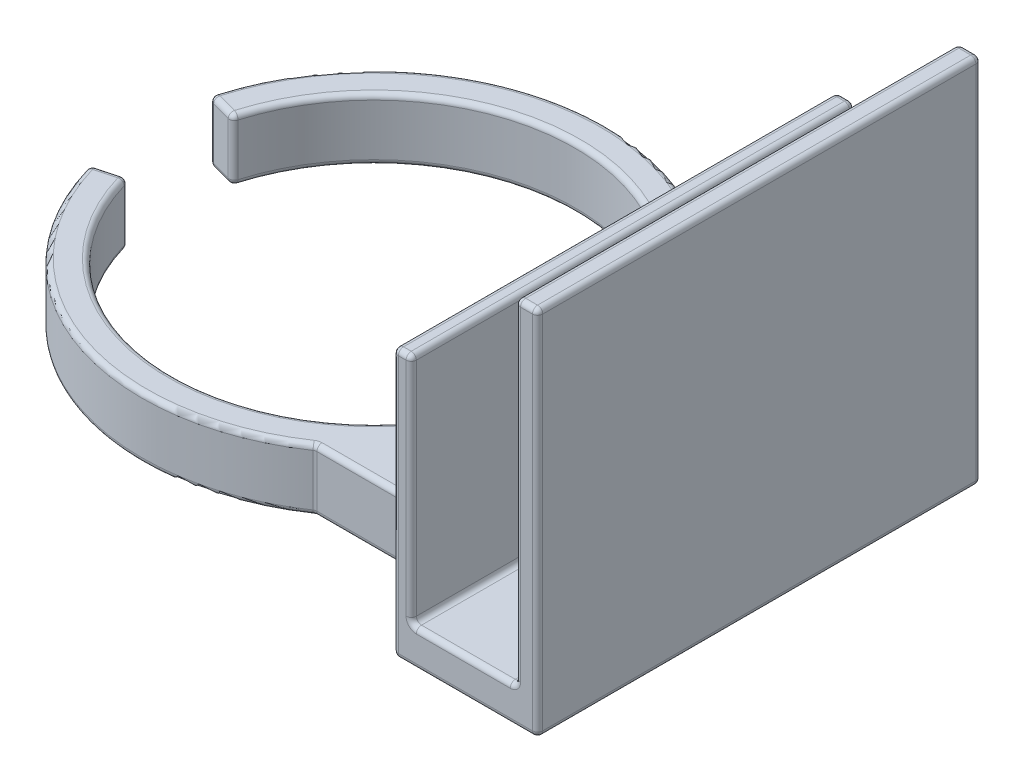
from build123d import *

# Parameters (mm, degrees)
BOSS_EXTRUDE1_DEPTH = 12
CUT_EXTRUDE2_DEPTH  = 89.047041819
SKETCH4_W           = 28
SKETCH4_H           = 43
BOSS_EXTRUDE2_DEPTH = 50
SKETCH5_W           = 28
SKETCH5_H           = 43
BOSS_EXTRUDE3_DEPTH = 10
SKETCH6_W           = 20.2
SKETCH6_H           = 43
CUT_EXTRUDE3_DEPTH  = 65
CUT_EXTRUDE4_REACH  = 120.334
SKETCH7_W           = 86
SKETCH7_H           = 20
FILLET5_R           = 1


with BuildPart() as part:
    # Sketch1 → Boss-Extrude1 (new body)
    with BuildSketch(Plane(origin=(0, 0, 0), x_dir=(1, 0, 0), z_dir=(0, 1, 0))):
        with BuildLine():
            Line((-45, 0), (74.72135955, 0))
            Line((74.72135955, 0), (74.72135955, 43))
            Line((74.72135955, 43), (46.72135955, 43))
            Line((46.72135955, 43), (46.72135955, 37))
            Line((46.72135955, 37), (25.61249695, 37))
            ThreePointArc((25.61249695, 37), (-20.885852116, 39.859518077), (-45, 0))
        make_face()
        with BuildLine():
            Line((46.72135955, 25), (46.72135955, 5))
            Line((46.72135955, 5), (44.72135955, 5))
            ThreePointArc((44.72135955, 5), (42.268901411, 15.438263292), (37.416573868, 25))
            Line((37.416573868, 25), (46.72135955, 25))
        make_face(mode=Mode.SUBTRACT)
    boss_extrude1 = extrude(amount=BOSS_EXTRUDE1_DEPTH)

    # Sketch3 → Cut-Extrude2 (cut, through all)
    with BuildSketch(Plane(origin=(0, 12, 0), x_dir=(1, 0, 0), z_dir=(0, 1, 0))):
        with BuildLine():
            Line((-43.466662183, 11.64685703), (-37.671107225, 10.093942759))
            ThreePointArc((-37.671107225, 10.093942759), (5.090521497, 38.666349594), (39, 0))
            Line((39, 0), (-45, 0))
            ThreePointArc((-45, 0), (-44.615018762, 5.87367865), (-43.466662183, 11.64685703))
        make_face()
    cut_extrude2 = extrude(amount=-CUT_EXTRUDE2_DEPTH, mode=Mode.SUBTRACT)

    # Sketch4 → Boss-Extrude2 (add)
    with BuildSketch(Plane(origin=(0, 12, 0), x_dir=(1, 0, 0), z_dir=(0, 1, 0))):
        with Locations((60.72135955, 21.5)):
            Rectangle(SKETCH4_W, SKETCH4_H)
    boss_extrude2 = extrude(amount=BOSS_EXTRUDE2_DEPTH)

    # Sketch5 → Boss-Extrude3 (add)
    with BuildSketch(Plane.XZ):
        with Locations((60.72135955, -21.5)):
            Rectangle(SKETCH5_W, SKETCH5_H)
    boss_extrude3 = extrude(amount=BOSS_EXTRUDE3_DEPTH)

    # Sketch6 → Cut-Extrude3 (cut)
    with BuildSketch(Plane(origin=(0, 62, 0), x_dir=(1, 0, 0), z_dir=(0, 1, 0))):
        with Locations((60.311688234, 21.5)):
            Rectangle(SKETCH6_W, SKETCH6_H)
    cut_extrude3 = extrude(amount=-CUT_EXTRUDE3_DEPTH, mode=Mode.SUBTRACT)

    # Mirror1: Boss-Extrude1, Cut-Extrude2, Boss-Extrude2, Boss-Extrude3, Cut-Extrude3 across plane
    add(boss_extrude1.mirror(Plane.XY))
    add(cut_extrude2.mirror(Plane.XY), mode=Mode.SUBTRACT)
    add(boss_extrude2.mirror(Plane.XY))
    add(boss_extrude3.mirror(Plane.XY))
    add(cut_extrude3.mirror(Plane.XY), mode=Mode.SUBTRACT)

    # Sketch7 → Cut-Extrude4 (cut, up to next)
    with BuildSketch(Plane.ZY.offset(-46.72135955), mode=Mode.PRIVATE) as cut_extrude4_sk1:
        with Locations((0, 52)):
            Rectangle(SKETCH7_W, SKETCH7_H)
    cut_extrude4_tool1 = extrude(cut_extrude4_sk1.sketch, amount=-CUT_EXTRUDE4_REACH, mode=Mode.PRIVATE) & part.part
    add(cut_extrude4_tool1.solids().sort_by_distance((46.72136, 52, 0))[0], mode=Mode.SUBTRACT)

    # Fillet5
    fillet5_edges = [part.edges().sort_by_distance(p)[0] for p in [
        (-15.504459638, 12, 42.244665123),
        (36.16692825, 12, 37),
        (25.61249695, 6, 37),
        (46.72135955, 6, 37),
        (74.72135955, 26, 43),
        (42.268901411, 12, 15.438263292),
        (45.72135955, 12, 5),
        (42.068966709, 12, 25),
        (-15.504459638, 0, 42.244665123),
        (25.61249695, 6, -37),
        (46.72135955, 6, -37),
        (36.16692825, 0, 37),
        (42.268901411, 0, 15.438263292),
        (37.416573868, 6, 25),
        (42.068966709, 0, 25),
        (46.72135955, 6, 25),
        (46.72135955, 6, 5),
        (45.72135955, 0, 5),
        (44.72135955, 6, 5),
        (74.72135955, 26, -43),
        (-43.466662183, 6, 11.64685703),
        (-37.671107225, 6, 10.093942759),
        (-40.568884704, 12, 10.870399894),
        (-40.568884704, 0, 10.870399894),
        (72.566523892, 62, 43),
        (46.72135955, 12, 31),
        (60.72135955, -10, 43),
        (46.72135955, 0, 31),
        (50.211688234, 19.5, 43),
        (70.411688234, 29.5, 43),
        (60.311688234, -3, 43),
        (42.268901411, 0, -15.438263292),
        (37.416573868, 6, -25),
        (45.72135955, 0, -5),
        (44.72135955, 6, -5),
        (46.72135955, 16, -43),
        (46.72135955, 16, 43),
        (46.72135955, 6, -5),
        (42.068966709, 0, -25),
        (50.211688234, 42, 0),
        (48.466523892, 42, -43),
        (48.466523892, 42, 43),
        (46.72135955, 42, 0),
        (46.72135955, 6, -25),
        (42.268901411, 12, -15.438263292),
        (45.72135955, 12, -5),
        (42.068966709, 12, -25),
        (36.16692825, 12, -37),
        (-40.568884704, 0, -10.870399894),
        (-43.466662183, 6, -11.64685703),
        (5.090521497, 0, 38.666349594),
        (-37.671107225, 6, -10.093942759),
        (5.090521497, 12, -38.666349594),
        (-40.568884704, 12, -10.870399894),
        (-15.504459638, 12, -42.244665123),
        (46.72135955, 12, 0),
        (46.72135955, 12, -31),
        (74.72135955, 62, 0),
        (72.566523892, 62, -43),
        (36.16692825, 0, -37),
        (46.72135955, 0, -31),
        (46.72135955, 0, 0),
        (74.72135955, -10, 0),
        (46.72135955, -10, 0),
        (60.72135955, -10, -43),
        (-15.504459638, 0, -42.244665123),
        (50.211688234, -3, 0),
        (60.311688234, -3, -43),
        (50.211688234, 19.5, -43),
        (70.411688234, -3, 0),
        (70.411688234, 29.5, -43),
        (70.411688234, 62, 0),
    ]]
    fillet(fillet5_edges, radius=FILLET5_R)


solid = part.part
